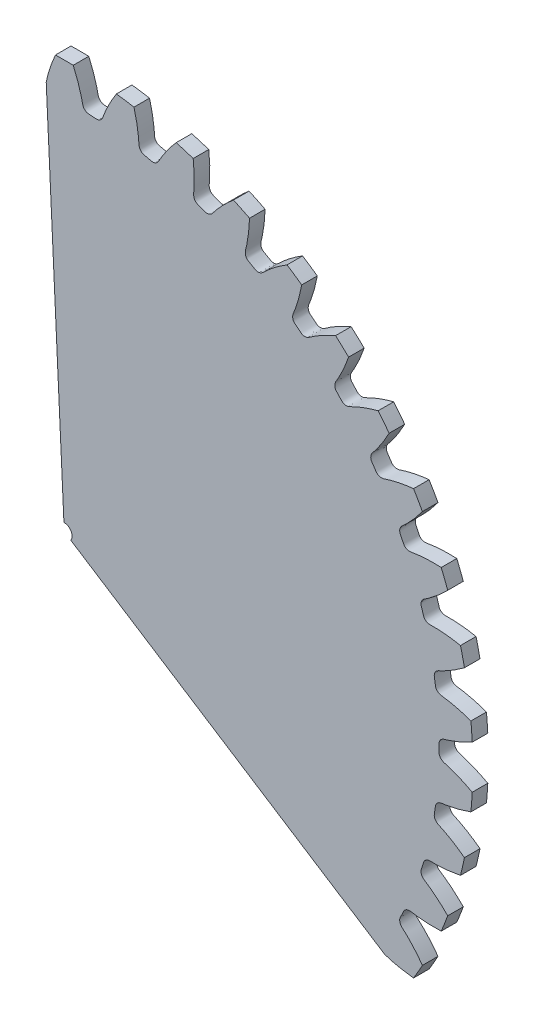
from build123d import *

# Parameters (mm, degrees)
SKETCHREVOLVEGEARTRAX1PINION_W       = 8
SKETCHREVOLVEGEARTRAX1PINION_H       = 209.980195238
TOOTHEXTRUDECUTGEARTRAX1PINION_DEPTH = 4
PATTERNGEARTRAX1PINION_COUNT         = 42
BOREREVOLVESKETCH_W                  = 8
BOREREVOLVESKETCH_H                  = 4
SKETCH1_OUTSIDE_W                    = 540.08
SKETCH1_OUTSIDE_H                    = 540.67
CUT_EXTRUDE1_DEPTH                   = 297.855935507


with BuildPart() as part:
    # SketchRevolveGeartrax1Pinion → Geartrax1Pinion (revolve)
    with BuildSketch(Plane(origin=(0, 0, 0), x_dir=(0, 0, -1), z_dir=(1, 0, 0))):
        with Locations((0, 104.990097619)):
            Rectangle(SKETCHREVOLVEGEARTRAX1PINION_W, SKETCHREVOLVEGEARTRAX1PINION_H)
    revolve(axis=Axis((0, 0, 0), (0, 0, -1)))

    # SketchToothGeartrax1Pinion → ToothExtrudeCutGeartrax1Pinion (cut, symmetric)
    with BuildSketch(Plane.XY):
        with BuildLine():
            ThreePointArc((210.059933834, 11.33399194), (210.36548, 0), (210.059933834, -11.33399194))
            add(Edge.make_bspline(
                [(210.059933834, -11.33399194), (209.421712001, -10.98805077), (208.471052933, -10.487497457), (207.208647382, -9.852911722), (206.295457125, -9.407970577), (205.403271631, -8.986874438), (204.532537889, -8.589031905), (203.683691431, -8.213844047), (202.85715618, -7.860704873), (202.053344474, -7.529001119), (201.272656478, -7.218113742), (200.515481788, -6.927413569), (199.782193278, -6.656277572), (199.073168377, -6.404032323), (198.388713668, -6.170154131), (197.729329514, -5.953566406), (197.094781685, -5.755104522), (196.206981038, -5.48295037), (195.441662388, -5.300071786), (194.837326585, -5.055686253), (194.618568492, -4.955054269), (194.391819671, -4.835690495), (194.153968078, -4.690839639), (193.902208025, -4.510782839), (193.635513374, -4.281846336), (193.357655143, -3.986067597), (193.081848485, -3.603213915), (192.837801446, -3.118326005), (192.668707899, -2.550089425), (192.596070969, -1.495109784), (192.677613048, 0), (192.596070969, 1.495109784), (192.668707899, 2.550089425), (192.837801446, 3.118326005), (193.081848485, 3.603213915), (193.357655143, 3.986067597), (193.635513374, 4.281846336), (193.902208025, 4.510782839), (194.153968078, 4.690839639), (194.391819671, 4.835690495), (194.618568492, 4.955054269), (194.837326585, 5.055686253), (195.441662388, 5.300071786), (196.206981038, 5.48295037), (197.094781685, 5.755104522), (197.729329514, 5.953566406), (198.388713668, 6.170154131), (199.073168377, 6.404032323), (199.782193278, 6.656277572), (200.515481788, 6.927413569), (201.272656478, 7.218113742), (202.053344474, 7.529001119), (202.85715618, 7.860704873), (203.683691431, 8.213844047), (204.532537889, 8.589031905), (205.403271631, 8.986874438), (206.295457125, 9.407970577), (207.208647382, 9.852911722), (208.471052933, 10.487497457), (209.421712001, 10.98805077), (210.059933834, 11.33399194)],
                knots=[0, 0, 0, 0, 0.048419669, 0.07165402, 0.094238049, 0.116171756, 0.137455141, 0.158088204, 0.178070945, 0.197403364, 0.216085461, 0.234117236, 0.251498689, 0.268229819, 0.284310628, 0.299741114, 0.314521279, 0.328651121, 0.361695917, 0.366792154, 0.372106347, 0.377751025, 0.383873891, 0.390667124, 0.398373715, 0.407280353, 0.417674397, 0.429732683, 0.443337286, 0.456891669, 0.5, 0.543108331, 0.556662714, 0.570267317, 0.582325603, 0.592719647, 0.601626285, 0.609332876, 0.616126109, 0.622248975, 0.627893653, 0.633207846, 0.638304083, 0.671348879, 0.685478721, 0.700258886, 0.715689372, 0.731770181, 0.748501311, 0.765882764, 0.783914539, 0.802596636, 0.821929055, 0.841911796, 0.862544859, 0.883828244, 0.905761951, 0.92834598, 0.951580331, 1, 1, 1, 1], degree=3))
        make_face()
    toothextrudecutgeartrax1pinion = extrude(amount=TOOTHEXTRUDECUTGEARTRAX1PINION_DEPTH, both=True, mode=Mode.SUBTRACT)

    # PatternGeartrax1Pinion: ToothExtrudeCutGeartrax1Pinion ×42 about axis
    patterngeartrax1pinion_axis = Axis((0, 0, 55), (0, 0, -1))
    for i in range(1, PATTERNGEARTRAX1PINION_COUNT):
        add(toothextrudecutgeartrax1pinion.rotate(patterngeartrax1pinion_axis, i * 360 / PATTERNGEARTRAX1PINION_COUNT), mode=Mode.SUBTRACT)

    # BoreRevolveSketch → BoreRevolveCut (revolve, cut)
    with BuildSketch(Plane(origin=(0, 0, 0), x_dir=(0, 0, -1), z_dir=(1, 0, 0))):
        with Locations((0, 2)):
            Rectangle(BOREREVOLVESKETCH_W, BOREREVOLVESKETCH_H)
    revolve(axis=Axis((0, 0, 0), (0, 0, -1)), mode=Mode.SUBTRACT)

    # Sketch1 outside → Cut-Extrude1 (cut, through all)
    with BuildSketch(Plane.XY.offset(4)):
        Rectangle(SKETCH1_OUTSIDE_W, SKETCH1_OUTSIDE_H)
        with BuildLine():
            Line((0, 0), (-9.980754911, 209.742859053))
            ThreePointArc((-9.980754911, 209.742859053), (181.848183368, 104.990097619), (176.652266747, -113.515016828))
            Line((176.652266747, -113.515016828), (0, 0))
        make_face(mode=Mode.SUBTRACT)
    extrude(amount=-CUT_EXTRUDE1_DEPTH, mode=Mode.SUBTRACT)


solid = part.part
